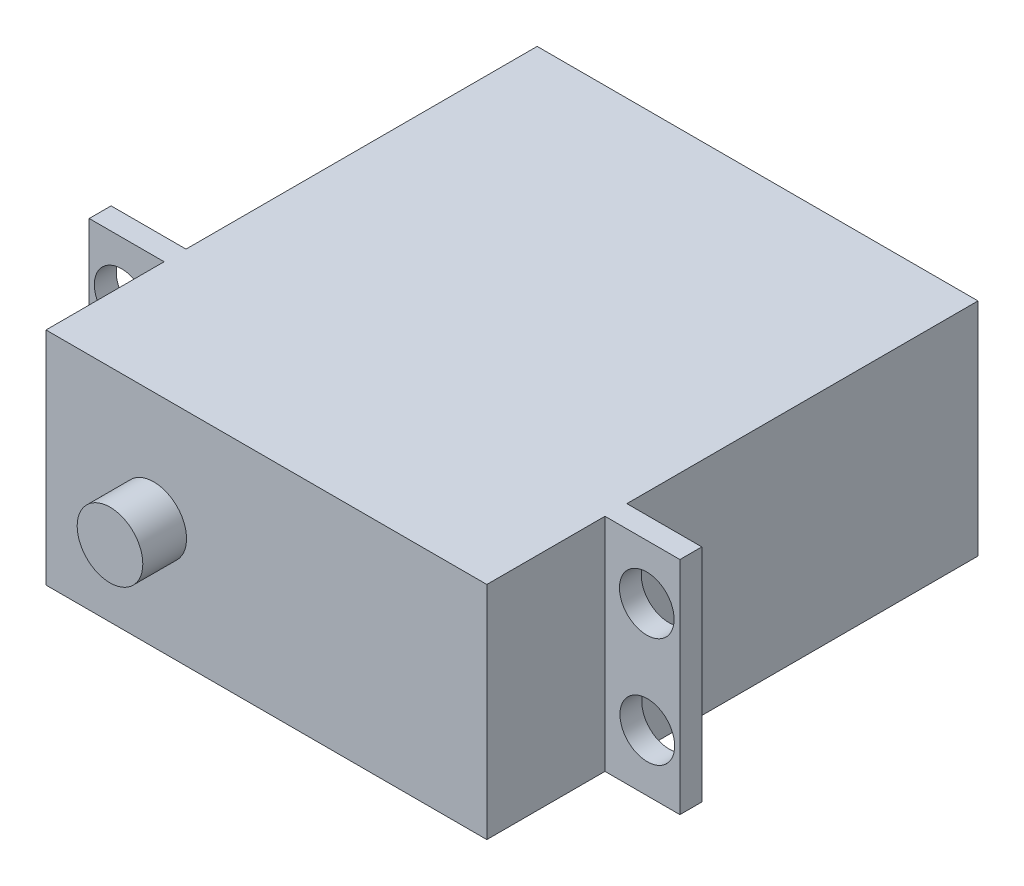
from build123d import *

# Parameters (mm, degrees)
ESQUISSE1_W             = 40.3
ESQUISSE1_H             = 20.2
BOSS_EXTRU_1_DEPTH      = 32.1
ESQUISSE2_W             = 54
ESQUISSE2_H             = 20.2
BOSS_EXTRU_2_DEPTH      = 2
ESQUISSE3_W             = 40.3
ESQUISSE3_H             = 20.2
BOSS_EXTRU_3_DEPTH      = 10.8
ESQUISSE4_R             = 3
BOSS_EXTRU_4_DEPTH      = 4
ESQUISSE5_R             = 2.5
ENL_V_MAT_EXTRU_1_DEPTH = 4


with BuildPart() as part:
    # Esquisse1 → Boss.-Extru.1 (new body)
    with BuildSketch(Plane.XY):
        with Locations((20.15, 5.491176471)):
            Rectangle(ESQUISSE1_W, ESQUISSE1_H)
    extrude(amount=BOSS_EXTRU_1_DEPTH)

    # Esquisse2 → Boss.-Extru.2 (add)
    with BuildSketch(Plane.XY.offset(32.1)):
        with Locations((20.15, 5.491176471)):
            Rectangle(ESQUISSE2_W, ESQUISSE2_H)
    extrude(amount=BOSS_EXTRU_2_DEPTH)

    # Esquisse3 → Boss.-Extru.3 (add)
    with BuildSketch(Plane.XY.offset(34.1)):
        with Locations((20.15, 5.491176471)):
            Rectangle(ESQUISSE3_W, ESQUISSE3_H)
    extrude(amount=BOSS_EXTRU_3_DEPTH)

    # Esquisse4 → Boss.-Extru.4 (add)
    with BuildSketch(Plane.XY.offset(44.9)):
        with Locations(Location((9.85, 5.491176471, 0), (0, 0, 180))):
            Circle(ESQUISSE4_R)
    extrude(amount=BOSS_EXTRU_4_DEPTH)

    # Esquisse5 → Enlèv. mat.-Extru.1 (cut)
    with BuildSketch(Plane.XY.offset(34.1)):
        with Locations((-3.88, 10.591176471)):
            Circle(ESQUISSE5_R)
        with Locations((-3.832055369, 0.591291406)):
            Circle(ESQUISSE5_R)
        with Locations((44.12, 10.591176471)):
            Circle(ESQUISSE5_R)
        with Locations((44.167944631, 0.591291406)):
            Circle(ESQUISSE5_R)
    extrude(amount=-ENL_V_MAT_EXTRU_1_DEPTH, mode=Mode.SUBTRACT)


solid = part.part
